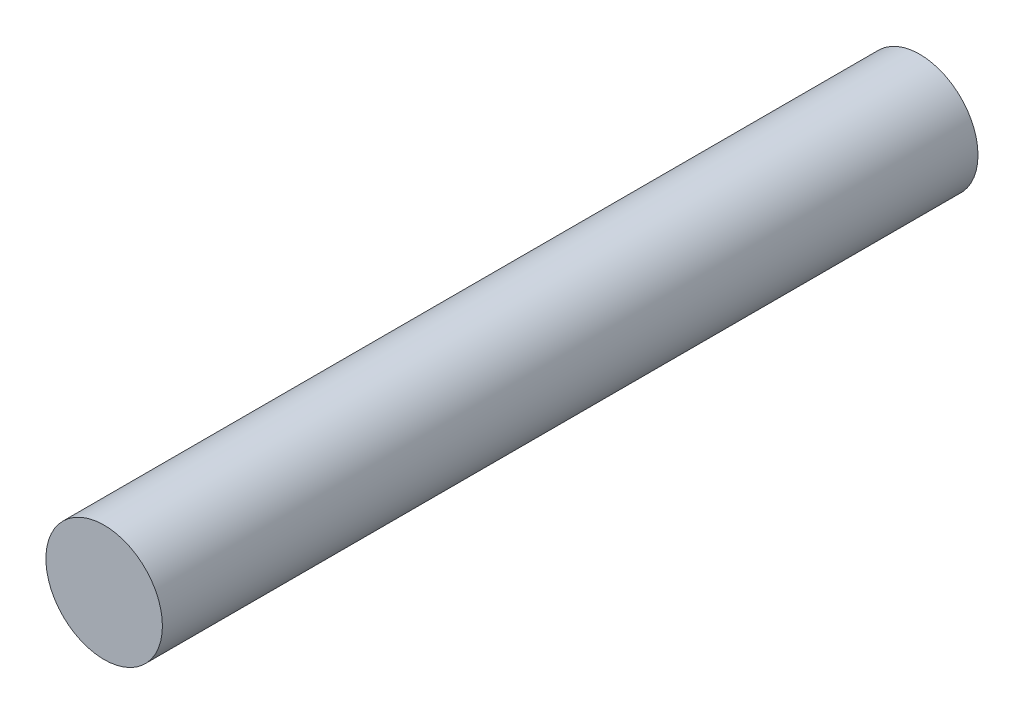
from build123d import *

# Parameters (mm, degrees)
SKETCH1_R           = 25
BOSS_EXTRUDE1_DEPTH = 350


with BuildPart() as part:
    # Sketch1 → Boss-Extrude1 (new body)
    with BuildSketch(Plane.XY):
        Circle(SKETCH1_R)
    extrude(amount=BOSS_EXTRUDE1_DEPTH)


solid = part.part
